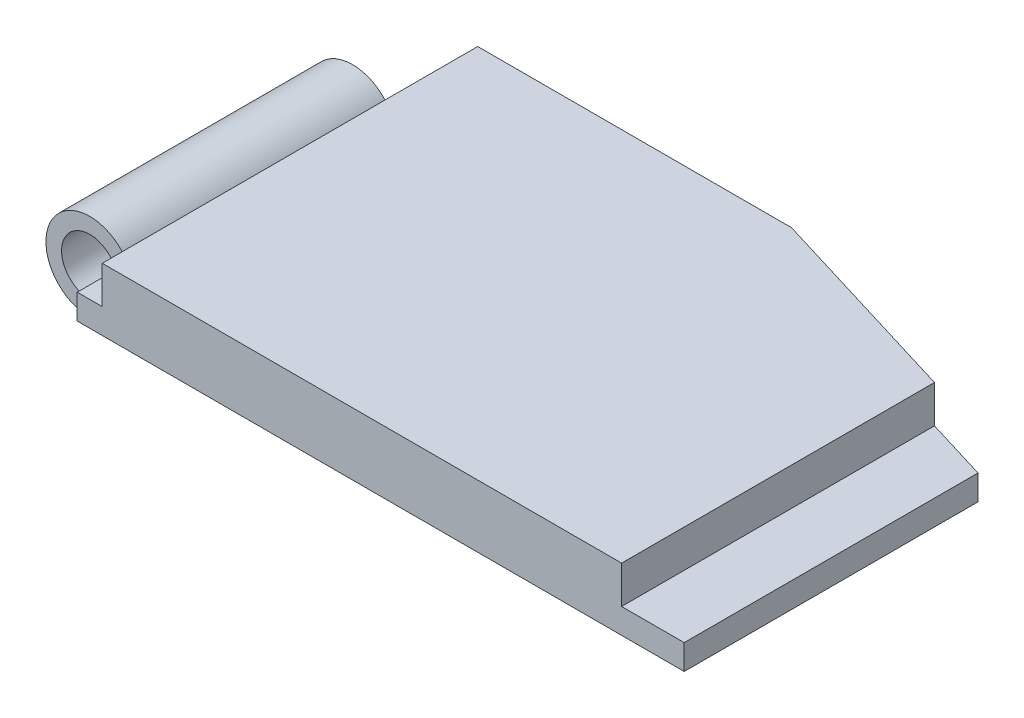
from build123d import *

# Parameters (mm, degrees)
SKETCH1_W                = 52
SKETCH1_H                = 30
BOSS_EXTRUDE1_DEPTH      = 2
SKETCH3_W                = 6
SKETCH3_H                = 3
BOSS_EXTRUDE3_DEPTH      = 7
SKETCH4_R                = 1
CUT_EXTRUDE1_DEPTH       = 56.342208124
BOSS_EXTRUDE4_DEPTH      = 10.5
BOSS_EXTRUDE4_DEPTH_BACK = 10.5
SKETCH5_R                = 3.5
SKETCH5_R_2              = 2.25
SKETCH6_R                = 2.25
CUT_EXTRUDE2_DEPTH       = 61.440052945
SKETCH7_W                = 4.769814724
SKETCH7_H                = 4.854263269
SKETCH7_W_2              = 3.5
SKETCH7_H_2              = 7.262003205
CUT_EXTRUDE3_DEPTH       = 61.704200843
SKETCH8_W                = 41.5
SKETCH8_H                = 30
BOSS_EXTRUDE5_DEPTH      = 3
CUT_EXTRUDE4_DEPTH       = 61.440052945


with BuildPart() as part:
    # Sketch1 → Boss-Extrude1 (new body)
    with BuildSketch(Plane(origin=(0, 0, 0), x_dir=(1, 0, 0), z_dir=(0, 1, 0))):
        with Locations((26, -15)):
            Rectangle(SKETCH1_W, SKETCH1_H)
    extrude(amount=BOSS_EXTRUDE1_DEPTH)

    # Sketch3 → Boss-Extrude3 (add)
    with BuildSketch(Plane.XZ):
        with Locations((26, 16.1)):
            Rectangle(SKETCH3_W, SKETCH3_H)
    extrude(amount=BOSS_EXTRUDE3_DEPTH)

    # Sketch4 → Cut-Extrude1 (cut, through all)
    with BuildSketch(Plane.XY.offset(17.6)):
        with Locations((26, -4)):
            Circle(SKETCH4_R)
    extrude(amount=-CUT_EXTRUDE1_DEPTH, mode=Mode.SUBTRACT)

    # Sketch6 → Cut-Extrude2 (cut, through all)
    with BuildSketch(Plane.XY.offset(30)):
        with Locations((0, -0.25)):
            Circle(SKETCH6_R)
    extrude(amount=-CUT_EXTRUDE2_DEPTH, mode=Mode.SUBTRACT)

    # Sketch7 → Cut-Extrude3 (cut, through all)
    with BuildSketch(Plane(origin=(0, 2, 0), x_dir=(1, 0, 0), z_dir=(0, 1, 0))):
        with Locations((1.115092638, -27.927131635)):
            Rectangle(SKETCH7_W, SKETCH7_H)
        with Locations((1.75, -0.868998397)):
            Rectangle(SKETCH7_W_2, SKETCH7_H_2)
    extrude(amount=-CUT_EXTRUDE3_DEPTH, mode=Mode.SUBTRACT)

    # Sketch8 → Boss-Extrude5 (add)
    with BuildSketch(Plane(origin=(0, 2, 0), x_dir=(1, 0, 0), z_dir=(0, 1, 0))):
        with Locations((26.25, -15)):
            Rectangle(SKETCH8_W, SKETCH8_H)
    extrude(amount=BOSS_EXTRUDE5_DEPTH)

    # Sketch9 → Cut-Extrude4 (cut, through all)
    with BuildSketch(Plane.XZ):
        Polygon((30.583920936, 0), (52, 6.523601303), (52, -3.845596105), (30.583920936, -3.845596105), align=None)
    extrude(amount=-CUT_EXTRUDE4_DEPTH, mode=Mode.SUBTRACT)


with BuildPart() as body_2:
    # Sketch5 → Boss-Extrude4 (new, two sides: drawn at the far end of the back side and taken through both)
    with BuildSketch(Plane.XY.offset(15).offset(-BOSS_EXTRUDE4_DEPTH_BACK)):
        with Locations((0, -0.25)):
            Circle(SKETCH5_R)
        with Locations((0, -0.25)):
            Circle(SKETCH5_R_2, mode=Mode.SUBTRACT)
    extrude(amount=BOSS_EXTRUDE4_DEPTH + BOSS_EXTRUDE4_DEPTH_BACK)


solid = Compound([part.part, body_2.part])
